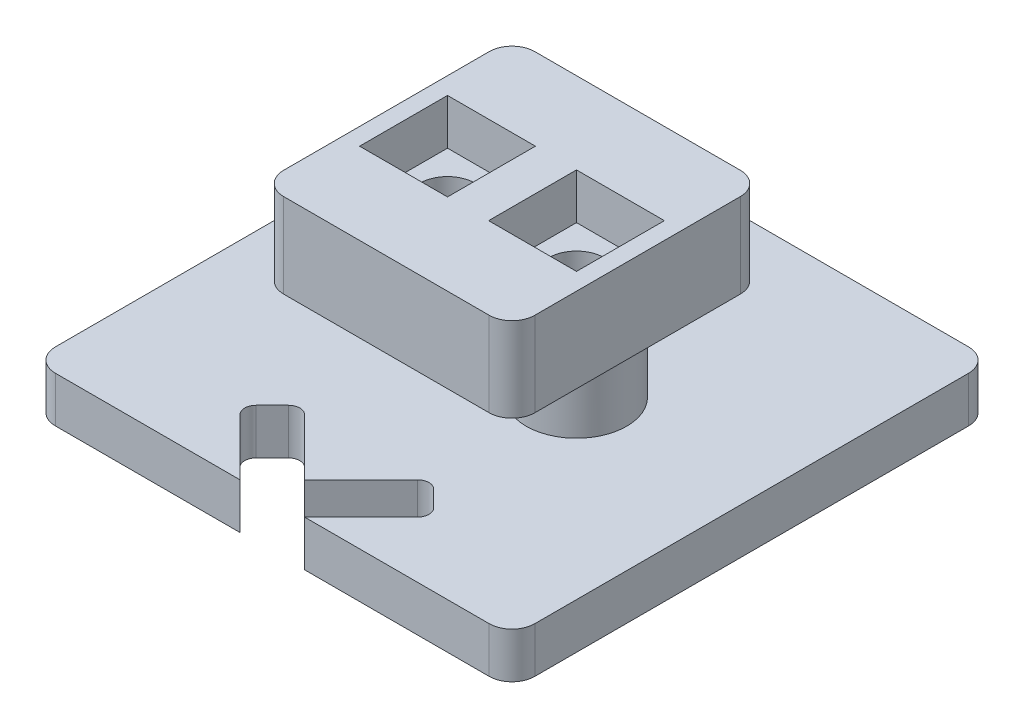
from build123d import *

# Parameters (mm, degrees)
SKETCH1_W           = 11
SKETCH1_H           = 11
BOSS_EXTRUDE1_DEPTH = 3.7
FILLET1_R           = 1
SKETCH2_W           = 3.85
SKETCH2_H           = 3.85
CUT_EXTRUDE1_DEPTH  = 2
SKETCH4_R           = 2.2
BOSS_EXTRUDE2_DEPTH = 5
BOSS_EXTRUDE3_DEPTH = 2
SKETCH3_R           = 1.2
CUT_EXTRUDE2_DEPTH  = 18.210171411
CUT_EXTRUDE3_DEPTH  = 17.290794947


with BuildPart() as part:
    # Sketch1 → Boss-Extrude1 (new body)
    with BuildSketch(Plane(origin=(0, 0, 0), x_dir=(1, 0, 0), z_dir=(0, 1, 0))):
        Rectangle(SKETCH1_W, SKETCH1_H)
    extrude(amount=BOSS_EXTRUDE1_DEPTH)

    # Fillet1
    fillet1_edges = [part.edges().sort_by_distance(p)[0] for p in [
        (5.5, 1.85, 5.5),
        (-5.5, 1.85, 5.5),
        (-5.5, 1.85, -5.5),
        (5.5, 1.85, -5.5),
    ]]
    fillet(fillet1_edges, radius=FILLET1_R)

    # Sketch2 → Cut-Extrude1 (cut)
    with BuildSketch(Plane(origin=(0, 3.7, 0), x_dir=(1, 0, 0), z_dir=(0, 1, 0))):
        with Locations((-2.825, 0)):
            Rectangle(SKETCH2_W, SKETCH2_H)
        with Locations((2.825, 0)):
            Rectangle(SKETCH2_W, SKETCH2_H)
    extrude(amount=-CUT_EXTRUDE1_DEPTH, mode=Mode.SUBTRACT)

    # Sketch4 → Boss-Extrude2 (add)
    with BuildSketch(Plane(origin=(0, 0, 0), x_dir=(-1, 0, 0), z_dir=(0, -1, 0))):
        with Locations(Location((2.825, 0, 0), (0, 0, 90))):
            Circle(SKETCH4_R)
        with Locations(Location((-2.825, 0, 0), (0, 0, 90))):
            Circle(SKETCH4_R)
    extrude(amount=BOSS_EXTRUDE2_DEPTH)

    # Sketch5 → Boss-Extrude3 (add)
    with BuildSketch(Plane(origin=(0, -5, 0), x_dir=(-1, 0, 0), z_dir=(0, -1, 0))):
        with BuildLine():
            Line((9.5, 10.5), (-9.5, 10.5))
            ThreePointArc((-9.5, 10.5), (-10.207106781, 10.207106781), (-10.5, 9.5))
            Line((-10.5, 9.5), (-10.5, -9.5))
            ThreePointArc((-10.5, -9.5), (-10.207106781, -10.207106781), (-9.5, -10.5))
            Line((-9.5, -10.5), (9.5, -10.5))
            ThreePointArc((9.5, -10.5), (10.207106781, -10.207106781), (10.5, -9.5))
            Line((10.5, -9.5), (10.5, 9.5))
            ThreePointArc((10.5, 9.5), (10.207106781, 10.207106781), (9.5, 10.5))
        make_face()
    extrude(amount=-BOSS_EXTRUDE3_DEPTH)

    # Sketch3 → Cut-Extrude2 (cut, through all)
    with BuildSketch(Plane(origin=(0, 3.7, 0), x_dir=(1, 0, 0), z_dir=(0, 1, 0))):
        with Locations(Location((-2.825, 0, 0), (0, 0, 270))):
            Circle(SKETCH3_R)
        with Locations(Location((2.825, 0, 0), (0, 0, 270))):
            Circle(SKETCH3_R)
    extrude(amount=-CUT_EXTRUDE2_DEPTH, mode=Mode.SUBTRACT)

    # Sketch7 → Cut-Extrude3 (cut, through all)
    with BuildSketch(Plane(origin=(0, -3, 0), x_dir=(1, 0, 0), z_dir=(0, 1, 0))):
        with BuildLine():
            Line((0, -9.085786438), (1.414213562, -10.5))
            Line((1.414213562, -10.5), (3.889087297, -8.025126266))
            ThreePointArc((3.889087297, -8.025126266), (4.035533906, -7.671572875), (3.889087297, -7.318019485))
            Line((3.889087297, -7.318019485), (3.181980515, -6.610912703))
            ThreePointArc((3.181980515, -6.610912703), (2.828427125, -6.464466094), (2.474873734, -6.610912703))
            Line((2.474873734, -6.610912703), (0, -9.085786438))
        make_face()
        with BuildLine():
            Line((-3.889087297, -8.025126266), (-1.414213562, -10.5))
            Line((-1.414213562, -10.5), (0, -9.085786438))
            Line((0, -9.085786438), (-2.474873734, -6.610912703))
            ThreePointArc((-2.474873734, -6.610912703), (-2.828427125, -6.464466094), (-3.181980515, -6.610912703))
            Line((-3.181980515, -6.610912703), (-3.889087297, -7.318019485))
            ThreePointArc((-3.889087297, -7.318019485), (-4.035533906, -7.671572875), (-3.889087297, -8.025126266))
        make_face()
        Polygon((-1.414213562, -10.5), (1.414213562, -10.5), (0, -9.085786438), align=None)
    extrude(amount=-CUT_EXTRUDE3_DEPTH, mode=Mode.SUBTRACT)


solid = part.part
